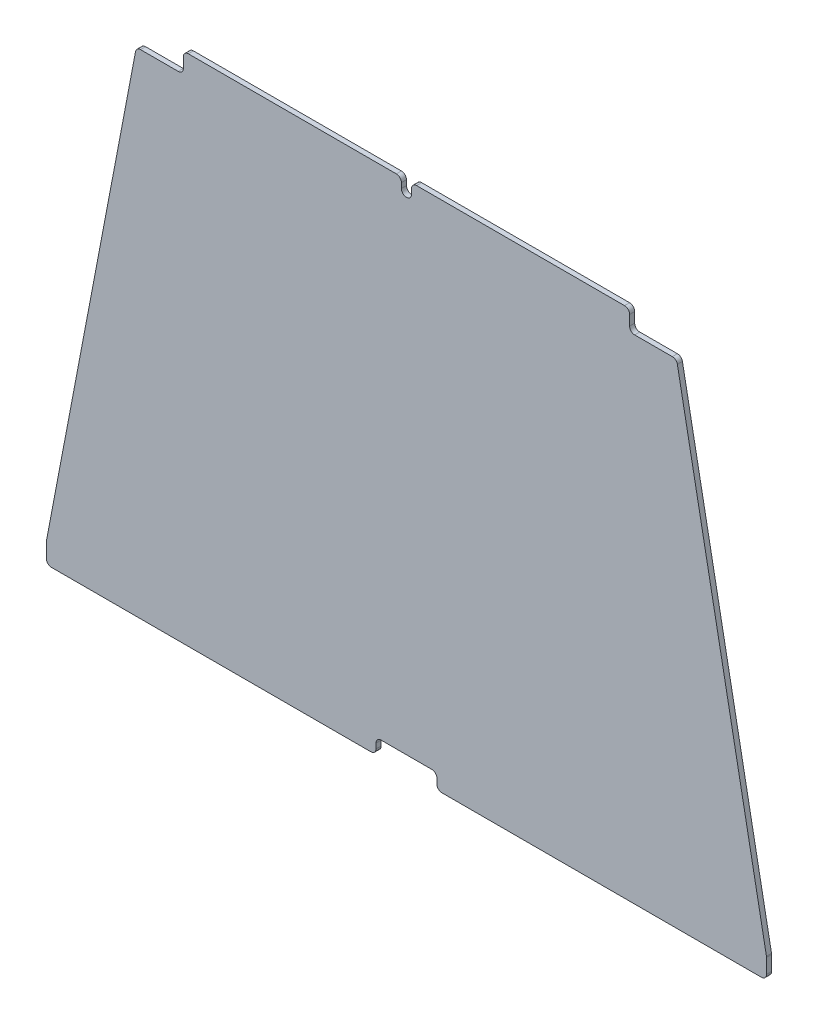
from build123d import *

# Parameters (mm, degrees)
EXTRUDE_1_DEPTH     = 5
CUT_EXTRUDE_1_DEPTH = 619.131054065
FILLET_1_R          = 5


with BuildPart() as part:
    # ｽｹｯﾁ2 → ﾎﾞｽ - 押し出し1 (new body)
    with BuildSketch(Plane.XY):
        Polygon((355, 0), (-355, 0), (-355, 20), (-262.5, 506), (262.5, 506), (355, 20), align=None)
    extrude(amount=EXTRUDE_1_DEPTH)

    # ｽｹｯﾁ3 → ｶｯﾄ - 押し出し1 (cut, through all)
    with BuildSketch(Plane.XY.offset(5)):
        Polygon((-262.5, 506), (-266.306584362, 486), (-220, 486), (-220, 506), align=None)
        Polygon((262.5, 506), (220, 506), (220, 486), (266.306584362, 486), align=None)
        with BuildLine():
            Line((5, 506), (-5, 506))
            Line((-5, 506), (-5, 496))
            ThreePointArc((-5, 496), (0, 491), (5, 496))
            Line((5, 496), (5, 506))
        make_face()
        with BuildLine():
            Line((-30, 10), (-30, 0))
            Line((-30, 0), (30, 0))
            Line((30, 0), (30, 10))
            ThreePointArc((30, 10), (28.535533906, 13.535533906), (25, 15))
            Line((25, 15), (-25, 15))
            ThreePointArc((-25, 15), (-28.535533906, 13.535533906), (-30, 10))
        make_face()
    extrude(amount=-CUT_EXTRUDE_1_DEPTH, mode=Mode.SUBTRACT)

    # ﾌｨﾚｯﾄ1
    fillet_1_edges = [part.edges().sort_by_distance(p)[0] for p in [
        (-355, 20, 2.5),
        (355, 20, 2.5),
        (355, 0, 2.5),
        (-355, 0, 2.5),
        (-220, 486, 2.5),
        (-266.306584362, 486, 2.5),
        (-220, 506, 2.5),
        (266.306584362, 486, 2.5),
        (220, 486, 2.5),
        (220, 506, 2.5),
        (-5, 506, 2.5),
        (5, 506, 2.5),
        (30, 0, 2.5),
        (-30, 0, 2.5),
    ]]
    fillet(fillet_1_edges, radius=FILLET_1_R)


solid = part.part
